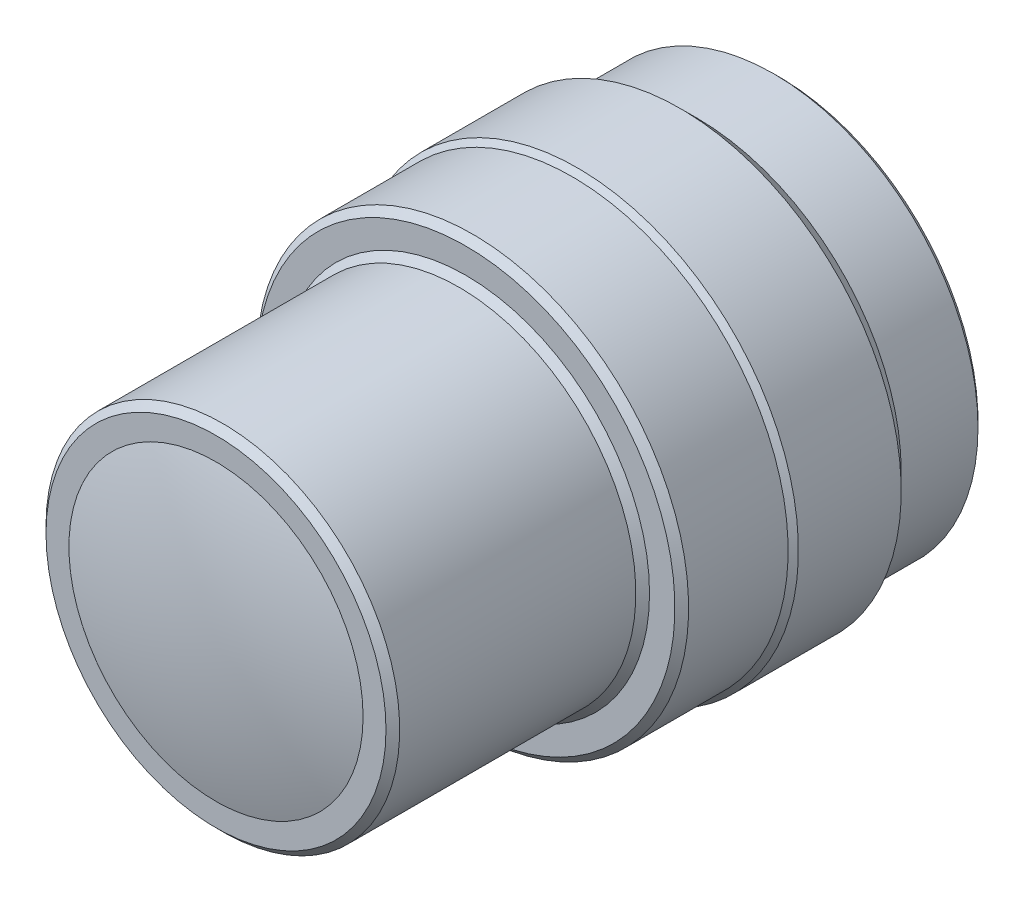
from build123d import *


with BuildPart() as part:
    # Эскиз1 → Повернуть1 (revolve)
    with BuildSketch(Plane(origin=(0, 0, 0), x_dir=(1, 0, 0), z_dir=(0, 1, 0)), mode=Mode.PRIVATE) as revolve_1_sk:
        Polygon((0, 0), (12.7, 0), (12.7, -3), (15, -3), (15, -4), (29, -4), (29.8, -4.8), (29.8, -16), (32.25, -18.45), (32.25, -33.45), (31.5, -34.2), (31.5, -48.72), (30.5, -49.72), (26.8, -49.72), (25.8, -50.72), (25.8, -85.17), (24.8, -86.17), (0, -86.17), align=None)
    revolve(revolve_1_sk.sketch.rotate(Axis((0, 0, 0), (0, 0, 1)), 180), axis=Axis((0, 0, 0), (0, 0, 1)))

    # Эскиз2 → Повернуть2 (revolve)
    with BuildSketch(Plane(origin=(0, 0, 0), x_dir=(1, 0, 0), z_dir=(0, 1, 0))):
        with BuildLine():
            Line((0, -86.17), (0, -89.17))
            ThreePointArc((0, -89.17), (10.83404162, -88.416370928), (21.459399602, -86.17))
            Line((21.459399602, -86.17), (0, -86.17))
        make_face()
    revolve(axis=Axis((0, 0, 2.482382031), (0, 0, -1)))


solid = part.part
